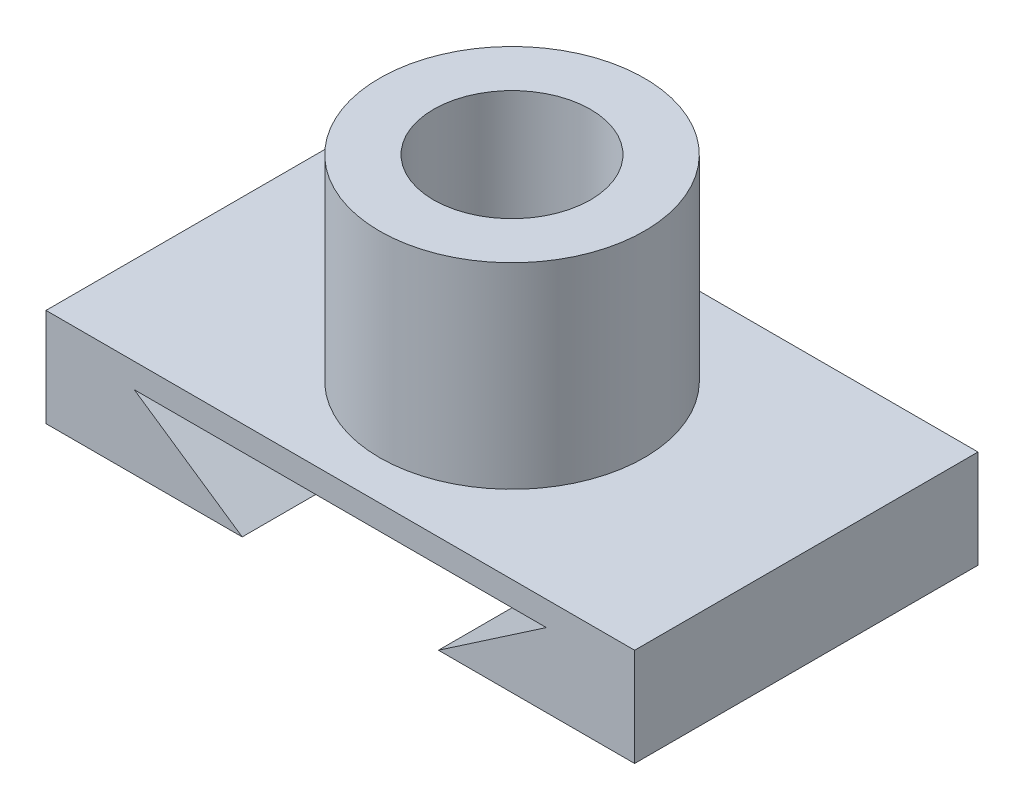
from build123d import *

# Parameters (mm, degrees)
EXTRUDE_1_DEPTH = 35
SKETCH_2_R      = 13.5
SKETCH_2_R_2    = 8
EXTRUDE_2_DEPTH = 20


with BuildPart() as part:
    # Эскиз1 → Бобышка-Вытянуть1 (new body)
    with BuildSketch(Plane.XY):
        Polygon((-30, 5), (-30, -5), (-10, -5), (-21, 2.5), (0, 2.5), (21, 2.5), (10, -5), (30, -5), (30, 5), align=None)
    extrude(amount=EXTRUDE_1_DEPTH)

    # Эскиз2 → Бобышка-Вытянуть2 (add)
    with BuildSketch(Plane(origin=(0, 5, 0), x_dir=(1, 0, 0), z_dir=(0, 1, 0))):
        with Locations((0, -17.5)):
            Circle(SKETCH_2_R)
        with Locations((0, -17.5)):
            Circle(SKETCH_2_R_2, mode=Mode.SUBTRACT)
    extrude(amount=EXTRUDE_2_DEPTH)


solid = part.part
